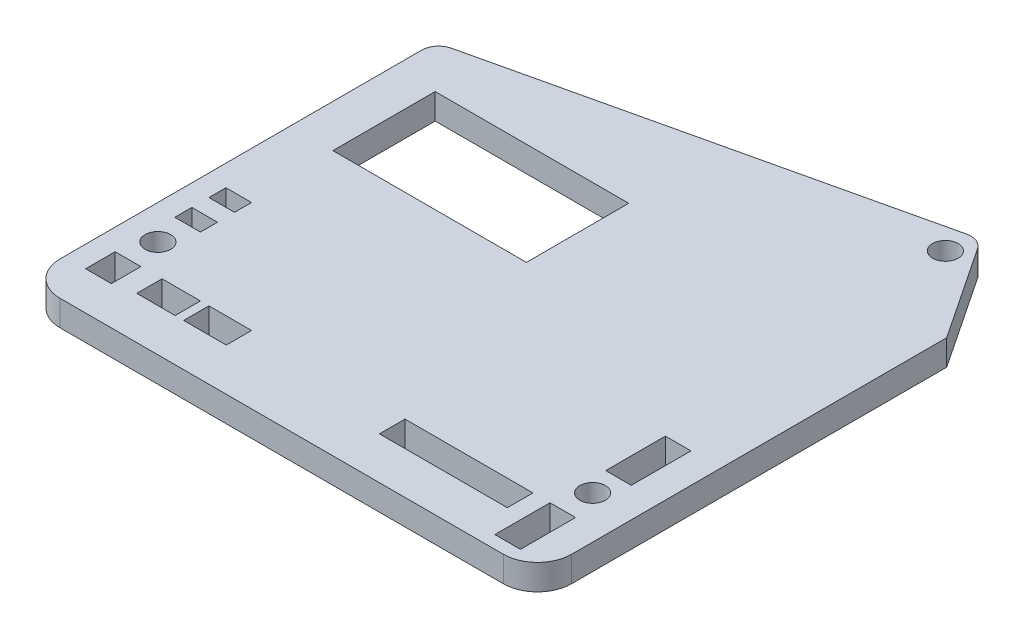
from build123d import *

# Parameters (mm, degrees)
CROQUIS1_R                 = 1.5
CROQUIS1_W                 = 3
CROQUIS1_H                 = 6.464673287
CROQUIS1_W_2               = 3.020034148
CROQUIS1_H_2               = 3.461191377
CROQUIS1_W_3               = 4.5
CROQUIS1_H_3               = 2.964673291
CROQUIS1_W_4               = 5
CROQUIS1_W_5               = 15
CROQUIS1_H_4               = 3
CROQUIS1_H_5               = 7
CROQUIS1_W_6               = 3.007385003
CROQUIS1_H_6               = 1.999998024
CROQUIS1_W_7               = 3.001763161
CROQUIS1_H_7               = 1.995781642
CROQUIS1_W_8               = 22.700000001
CROQUIS1_H_8               = 12
SALIENTE_EXTRUIR1_DEPTH    = 3
S_LIDO_MOVER_COPIAR1_ANGLE = 90


with BuildPart() as part:
    # Croquis1 → Saliente-Extruir1 (new body)
    with BuildSketch(Plane.XY):
        with BuildLine():
            Line((41808.502638122, -312.734450912), (41808.502638122, -355.143425671))
            ThreePointArc((41808.502638122, -355.143425671), (41808.937480298, -356.388528473), (41810.052919108, -357.092208062))
            Line((41810.052919108, -357.092208062), (41859.155637399, -368.423604591))
            ThreePointArc((41859.155637399, -368.423604591), (41860.343476449, -368.333633328), (41861.269457002, -367.584222592))
            Line((41861.269457002, -367.584222592), (41868.502638122, -356.734450911))
            Line((41868.502638122, -356.734450911), (41868.502638122, -312.734450912))
            ThreePointArc((41868.502638122, -312.734450912), (41867.331065246, -309.906023787), (41864.502638122, -308.734450912))
            Line((41864.502638122, -308.734450912), (41812.502638122, -308.734450912))
            ThreePointArc((41812.502638122, -308.734450912), (41809.674210997, -309.906023787), (41808.502638122, -312.734450912))
        make_face()
        with Locations((41859.605356413, -365.4748222)):
            Circle(CROQUIS1_R, mode=Mode.SUBTRACT)
        with Locations((41812.517756121, -320.195638832)):
            Circle(CROQUIS1_R, mode=Mode.SUBTRACT)
        with Locations((41863.502638122, -320.199124199)):
            Circle(CROQUIS1_R, mode=Mode.SUBTRACT)
        with Locations((41863.502638122, -313.466787555)):
            Rectangle(CROQUIS1_W, CROQUIS1_H, mode=Mode.SUBTRACT)
        with Locations((41812.512655196, -314.965046601)):
            Rectangle(CROQUIS1_W_2, CROQUIS1_H_2, mode=Mode.SUBTRACT)
        with Locations((41818.752638122, -315.216787557)):
            Rectangle(CROQUIS1_W_3, CROQUIS1_H_3, mode=Mode.SUBTRACT)
        with Locations((41824.502638122, -315.216787557)):
            Rectangle(CROQUIS1_W_4, CROQUIS1_H_3, mode=Mode.SUBTRACT)
        with Locations((41852.502638122, -315.199124203)):
            Rectangle(CROQUIS1_W_5, CROQUIS1_H_4, mode=Mode.SUBTRACT)
        with Locations((41863.502638122, -326.734450912)):
            Rectangle(CROQUIS1_W, CROQUIS1_H_5, mode=Mode.SUBTRACT)
        with Locations((41812.506330624, -324.695634388)):
            Rectangle(CROQUIS1_W_6, CROQUIS1_H_6, mode=Mode.SUBTRACT)
        with Locations((41812.503519702, -328.697738628)):
            Rectangle(CROQUIS1_W_7, CROQUIS1_H_7, mode=Mode.SUBTRACT)
        with Locations((41824.852638123, -345.734450912)):
            Rectangle(CROQUIS1_W_8, CROQUIS1_H_8, mode=Mode.SUBTRACT)
    extrude(amount=SALIENTE_EXTRUIR1_DEPTH)


with BuildPart() as part_1:
    # Sólido-Mover/Copiar1: moved
    add(part.part.rotate(Axis((0, -338.604636556, 1.5), (1, 0, 0)), S_LIDO_MOVER_COPIAR1_ANGLE))


solid = part_1.part
